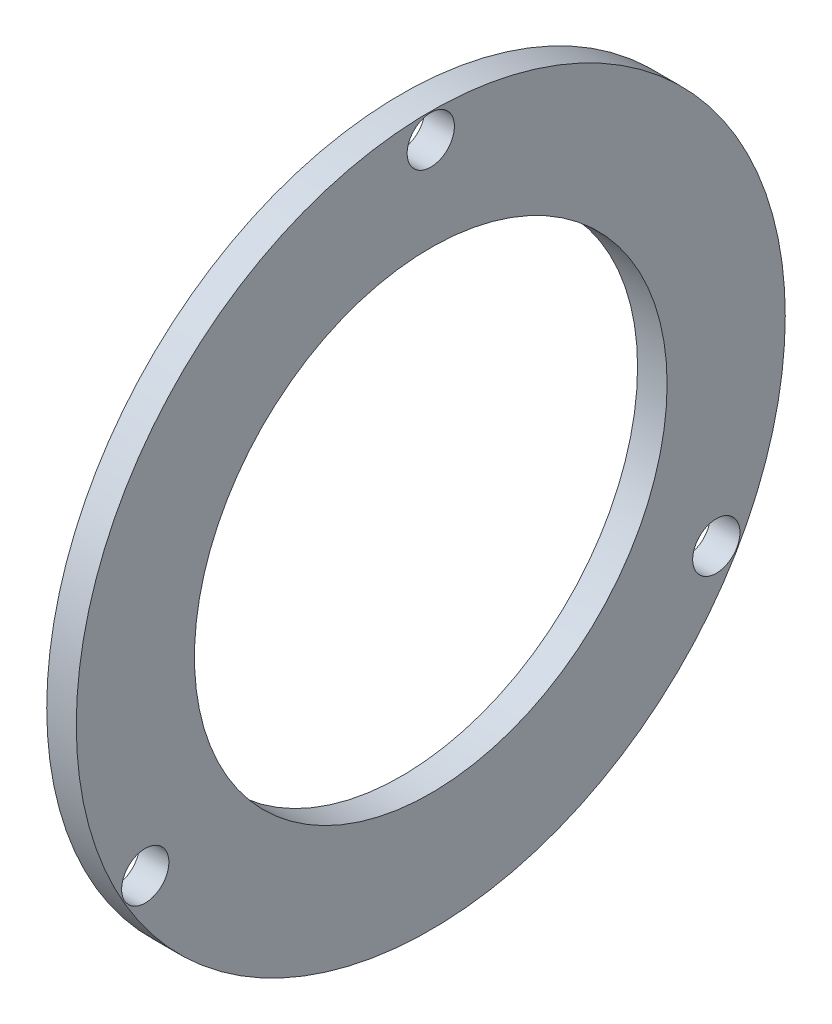
from build123d import *

# Parameters (mm, degrees)
SKETCH1_R           = 76.2
SKETCH1_R_2         = 50.8
SKETCH1_R_3         = 5.08
BOSS_EXTRUDE1_DEPTH = 6.35


with BuildPart() as part:
    # Sketch1 → Boss-Extrude1 (new body)
    with BuildSketch(Plane(origin=(0, 0, 0), x_dir=(0, 0, -1), z_dir=(1, 0, 0))):
        Circle(SKETCH1_R)
        Circle(SKETCH1_R_2, mode=Mode.SUBTRACT)
        with Locations((0, 70.866)):
            Circle(SKETCH1_R_3, mode=Mode.SUBTRACT)
        with Locations((61.371756265, -35.433)):
            Circle(SKETCH1_R_3, mode=Mode.SUBTRACT)
        with Locations((-61.371756265, -35.433)):
            Circle(SKETCH1_R_3, mode=Mode.SUBTRACT)
    extrude(amount=BOSS_EXTRUDE1_DEPTH)


solid = part.part
